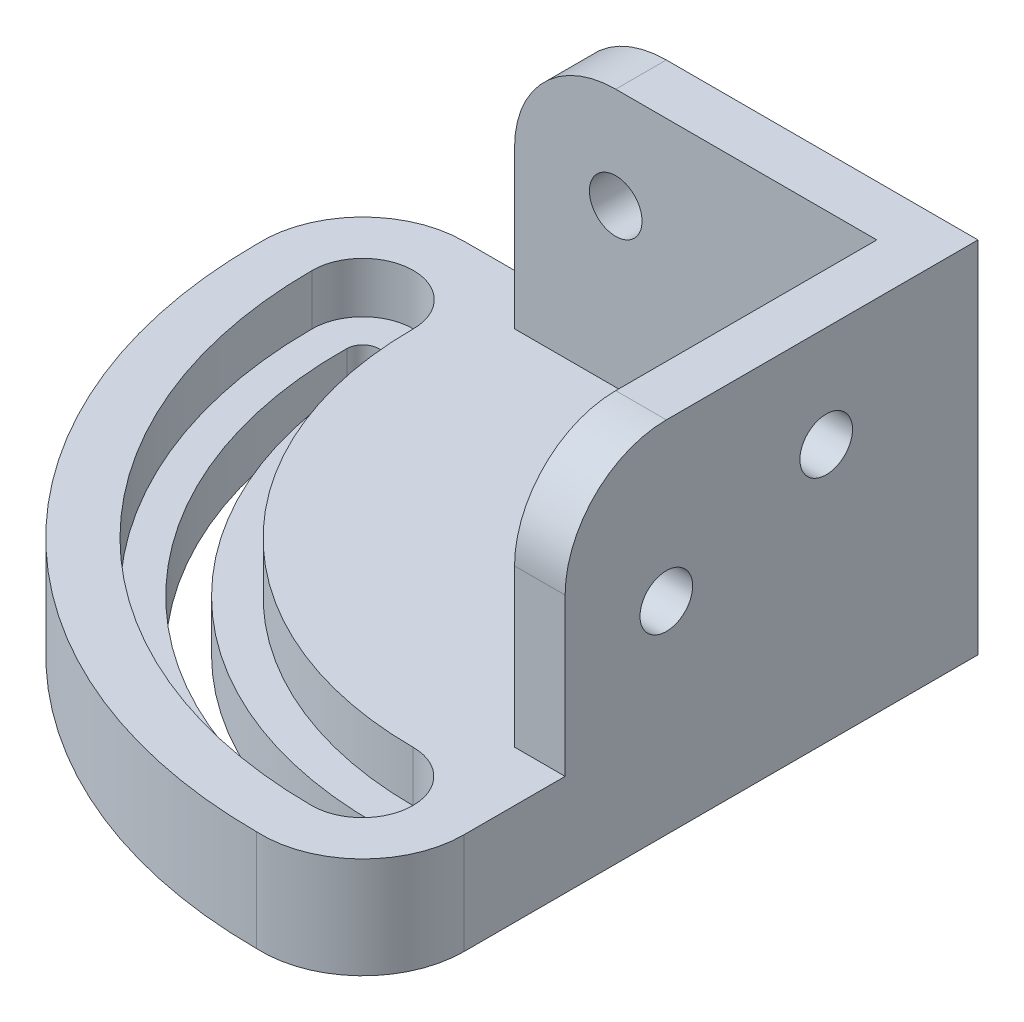
from build123d import *

# Parameters (mm, degrees)
BOSS_EXTRUDE1_DEPTH = 10
CUT_EXTRUDE1_DEPTH  = 5
SKETCH4_R           = 2.6
BOSS_EXTRUDE2_DEPTH = 5
SKETCH5_R           = 2.6
BOSS_EXTRUDE3_DEPTH = 5


with BuildPart() as part:
    # Sketch1 → Boss-Extrude1 (new body)
    with BuildSketch(Plane(origin=(0, 0, 0), x_dir=(1, 0, 0), z_dir=(0, 1, 0))):
        with BuildLine():
            Line((-25.4, 25.4), (25.4, 25.4))
            Line((25.4, 25.4), (25.4, -25.4))
            ThreePointArc((25.4, -25.4), (22.285670886, -32.651726446), (14.882492711, -35.386600333))
            ThreePointArc((14.882492711, -35.386600333), (-20.663123864, -20.663123864), (-35.386600333, 14.882492711))
            ThreePointArc((-35.386600333, 14.882492711), (-32.651726446, 22.285670886), (-25.4, 25.4))
        make_face()
        with BuildLine():
            ThreePointArc((-26.999867981, 15.420553429), (-14.735252362, -14.735252362), (15.420553429, -26.999867981))
            ThreePointArc((15.420553429, -26.999867981), (16.999867981, -25.379446571), (15.379446571, -23.800132019))
            ThreePointArc((15.379446571, -23.800132019), (-12.472510663, -12.472510663), (-23.800132019, 15.379446571))
            ThreePointArc((-23.800132019, 15.379446571), (-25.379446571, 16.999867981), (-26.999867981, 15.420553429))
        make_face(mode=Mode.SUBTRACT)
    extrude(amount=BOSS_EXTRUDE1_DEPTH)

    # Sketch3 → Cut-Extrude1 (cut)
    with BuildSketch(Plane(origin=(0, 10, 0), x_dir=(1, 0, 0), z_dir=(0, 1, 0))):
        with BuildLine():
            ThreePointArc((-30.399999366, 15.402518802), (-17.001804661, -16.989729027), (15.376927769, -30.420552794))
            ThreePointArc((15.376927769, -30.420552794), (20.379445937, -25.423072231), (15.381965374, -20.420554063))
            ThreePointArc((15.381965374, -20.420554063), (-9.927175622, -9.922224237), (-20.400000634, 15.397481198))
            ThreePointArc((-20.400000634, 15.397481198), (-25.397481198, 20.399999366), (-30.399999366, 15.402518802))
        make_face()
    extrude(amount=-CUT_EXTRUDE1_DEPTH, mode=Mode.SUBTRACT)

    # Sketch4 → Boss-Extrude2 (add)
    with BuildSketch(Plane(origin=(25.4, 0, 0), x_dir=(0, 0, -1), z_dir=(1, 0, 0))):
        with BuildLine():
            Line((-15.4, 25.50929881), (-15.4, 0))
            Line((-15.4, 0), (25.4, 0))
            Line((25.4, 0), (25.4, 35.50929881))
            Line((25.4, 35.50929881), (-5.4, 35.50929881))
            ThreePointArc((-5.4, 35.50929881), (-12.471067812, 32.580366621), (-15.4, 25.50929881))
        make_face()
        with Locations((10.4, 25.50929881)):
            Circle(SKETCH4_R, mode=Mode.SUBTRACT)
        with Locations((-5.4, 20)):
            Circle(SKETCH4_R, mode=Mode.SUBTRACT)
    extrude(amount=-BOSS_EXTRUDE2_DEPTH)

    # Sketch5 → Boss-Extrude3 (add)
    with BuildSketch(Plane(origin=(0, 0, -25.4), x_dir=(-1, 0, 0), z_dir=(0, 0, -1))):
        with BuildLine():
            Line((5.4, 35.50929881), (-25.4, 35.50929881))
            Line((-25.4, 35.50929881), (-25.4, 0))
            Line((-25.4, 0), (15.4, 0))
            Line((15.4, 0), (15.4, 25.50929881))
            ThreePointArc((15.4, 25.50929881), (12.471067812, 32.580366621), (5.4, 35.50929881))
        make_face()
        with Locations((5.4, 25.50929881)):
            Circle(SKETCH5_R, mode=Mode.SUBTRACT)
        with Locations((-10.4, 20)):
            Circle(SKETCH5_R, mode=Mode.SUBTRACT)
    extrude(amount=-BOSS_EXTRUDE3_DEPTH)


solid = part.part
